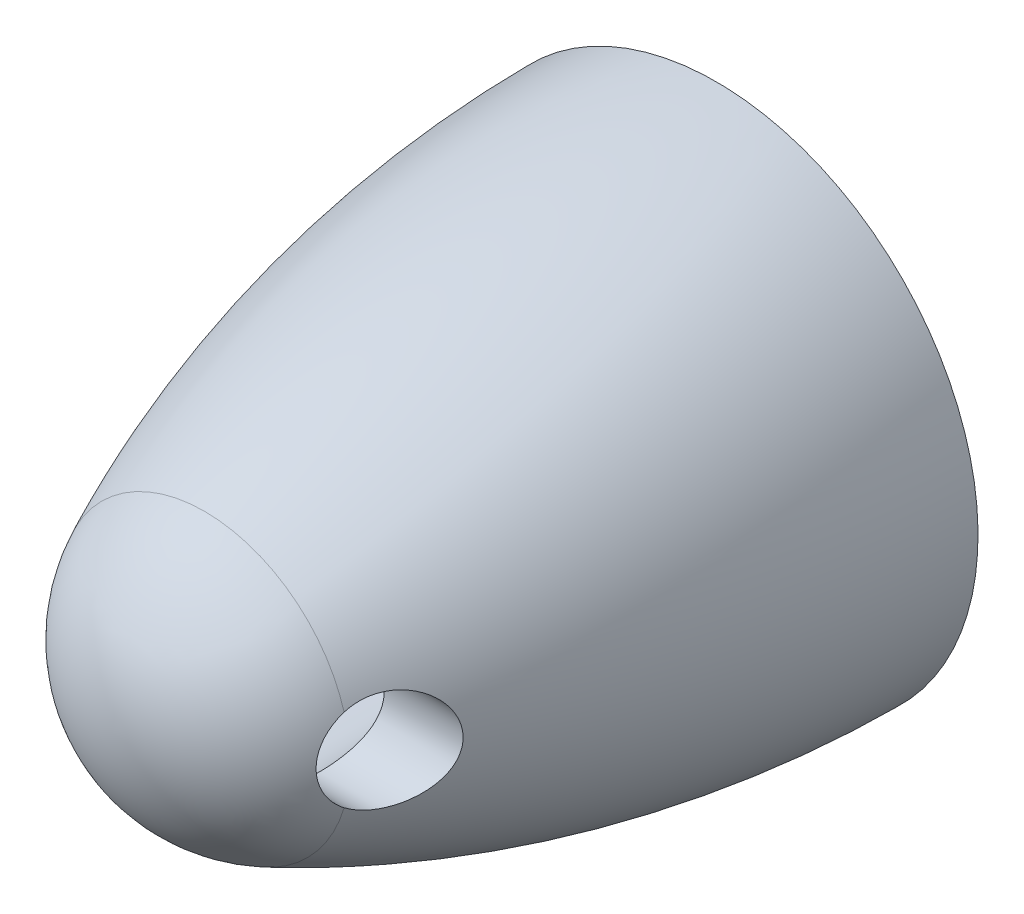
from build123d import *

# Parameters (mm, degrees)
M6X1_0_TAPPED_HOLE1_D     = 5
M6X1_0_TAPPED_HOLE1_DEPTH = 12.99972
M6X1_0_TAPPED_HOLE1_TIP   = 1.502151548
SKETCH4_R                 = 1.25
CUT_EXTRUDE1_DEPTH        = 12.7


with BuildPart() as part:
    # Sketch1 → Revolve1 (revolve)
    with BuildSketch(Plane(origin=(0, 0, 0), x_dir=(0, 0, -1), z_dir=(1, 0, 0)), mode=Mode.PRIVATE) as revolve1_sk:
        with BuildLine():
            Line((-15, 0), (0, 0))
            Line((0, 0), (0, 6.4997425))
            ThreePointArc((0, 6.4997425), (-6.51425993, 5.756273724), (-12.71143042, 3.615384615))
            ThreePointArc((-12.71143042, 3.615384615), (-14.379772306, 2.13942496), (-15, 0))
        make_face()
    revolve(revolve1_sk.sketch.rotate(Axis((0, 0, 0), (0, 0, 1)), 90), axis=Axis((0, 0, 0), (0, 0, 1)))

    # M6x1.0 Tapped Hole1
    with Locations(Plane(origin=(0, 0, 0), x_dir=(-1, 0, 0), z_dir=(0, 0, -1))):
        with Locations((0, 0)):
            Hole(M6X1_0_TAPPED_HOLE1_D / 2, depth=M6X1_0_TAPPED_HOLE1_DEPTH)
            with Locations((0, 0, -(M6X1_0_TAPPED_HOLE1_DEPTH + M6X1_0_TAPPED_HOLE1_TIP / 2))):  # 118° drill point
                Cone(0, M6X1_0_TAPPED_HOLE1_D / 2, M6X1_0_TAPPED_HOLE1_TIP, mode=Mode.SUBTRACT)

    # Sketch4 → Cut-Extrude1 (cut, symmetric)
    with BuildSketch(Plane(origin=(0, 0, 0), x_dir=(0, 0, -1), z_dir=(1, 0, 0))):
        with Locations(Location((-12, 0, 0), (0, 0, 290.171984379))):
            Circle(SKETCH4_R)
    extrude(amount=CUT_EXTRUDE1_DEPTH, both=True, mode=Mode.SUBTRACT)


solid = part.part
